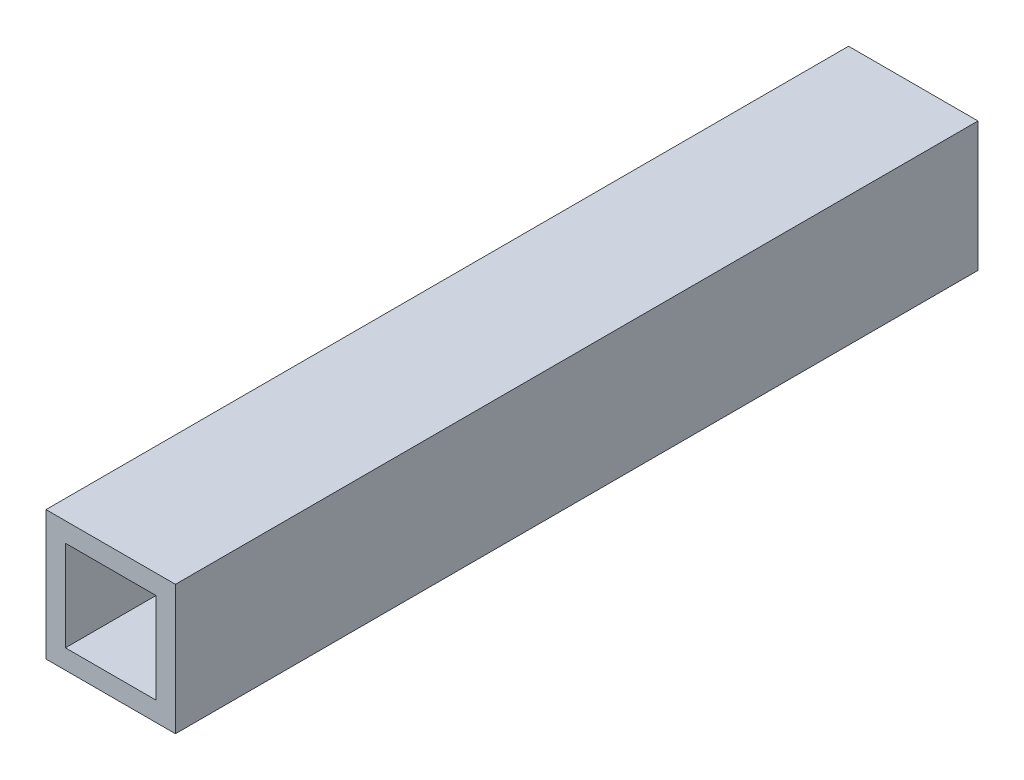
from build123d import *

# Parameters (mm, degrees)
SKETCH1_W           = 10
SKETCH1_H           = 10
SKETCH1_W_2         = 7
SKETCH1_H_2         = 7
BOSS_EXTRUDE1_DEPTH = 62


with BuildPart() as part:
    # Sketch1 → Boss-Extrude1 (new body)
    with BuildSketch(Plane.XY):
        Rectangle(SKETCH1_W, SKETCH1_H)
        Rectangle(SKETCH1_W_2, SKETCH1_H_2, mode=Mode.SUBTRACT)
    extrude(amount=BOSS_EXTRUDE1_DEPTH)


solid = part.part
